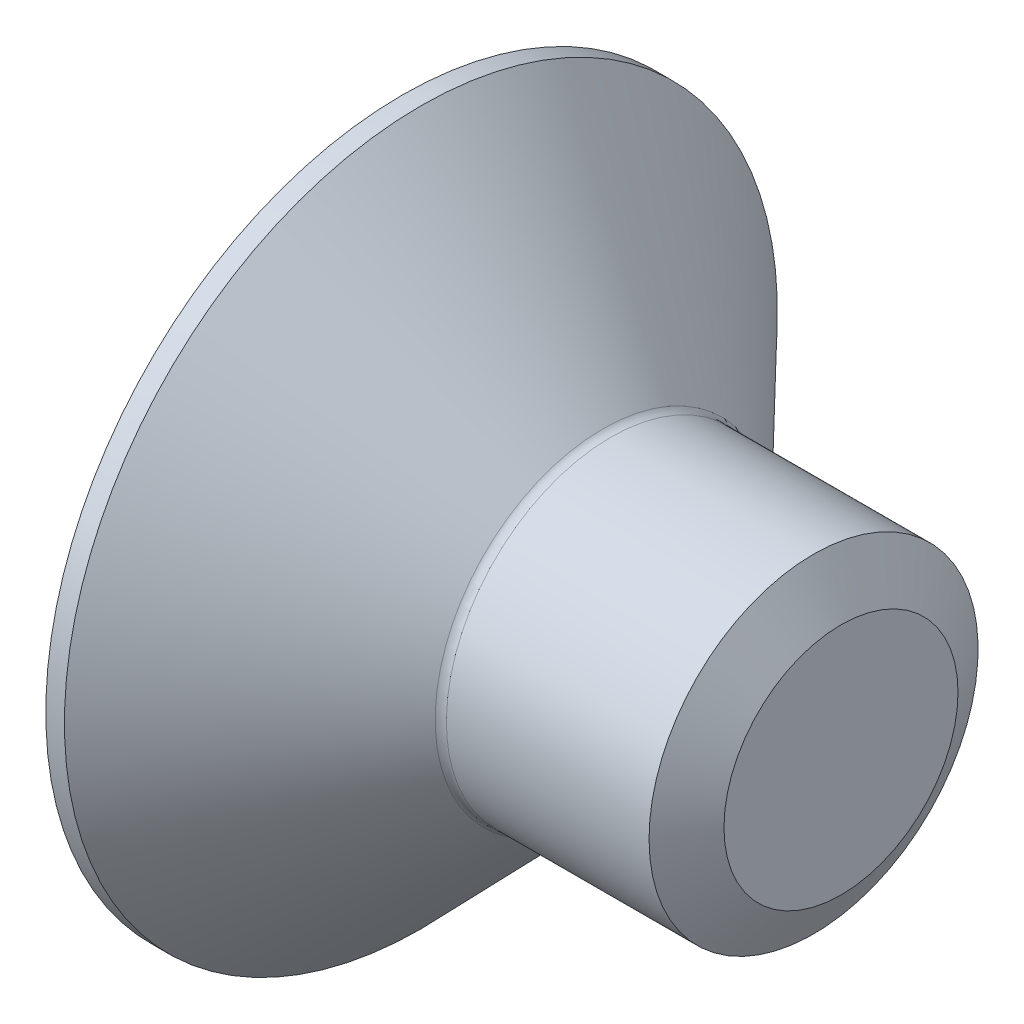
from build123d import *

# Parameters (mm, degrees)
CUT_EXTRUDE_1_DEPTH = 1.96


with BuildPart() as part:
    # 草图1 → 旋转1 (revolve)
    with BuildSketch(Plane.XY):
        with BuildLine():
            Line((0, 1.5), (-2.097552518, 1.5))
            ThreePointArc((-2.097552518, 1.5), (-2.136625631, 1.507949515), (-2.169486498, 1.530534163))
            Line((-2.169486498, 1.530534163), (-3.829955356, 3.25))
            Line((-3.829955356, 3.25), (-4, 3.25))
            Line((-4, 3.25), (-4, 0))
            Line((-4, 0), (0, 0))
            Line((0, 0), (0, 1.5))
        make_face()
    revolve(axis=Axis((0, 0, 0), (-1, 0, 0)))

    # 草图2 → 切除-拉伸1 (cut)
    with BuildSketch(Plane.ZY.offset(4)):
        Polygon((0, 1.154700538), (-1, 0.577350269), (-1, -0.577350269), (0, -1.154700538), (1, -0.577350269), (1, 0.577350269), align=None)
    extrude(amount=-CUT_EXTRUDE_1_DEPTH, mode=Mode.SUBTRACT)

    # 草图6 → 旋转2 (revolve)
    with BuildSketch(Plane.XY):
        Polygon((-2.9, 1.154700538), (-2.233333333, 0), (-1.74, 0), (-1.74, 1.154700538), align=None)
    revolve(axis=Axis((-4, 0, 0), (1, 0, 0)))

    # 草图7 → 切除-旋转2 (revolve, cut)
    with BuildSketch(Plane.XY):
        Polygon((-4, 1.154700538), (-4, 0), (-3.67, 0), align=None)
    revolve(axis=Axis((-4, 0, 0), (1, 0, 0)), mode=Mode.SUBTRACT)

    # 草图4 → 切除-旋转1 (revolve, cut)
    with BuildSketch(Plane.XY):
        Polygon((-0.25, 1.5), (0, 1.066987298), (0.25, 1.5), align=None)
    revolve(axis=Axis((-0.25, 0, 0), (1, 0, 0)), mode=Mode.SUBTRACT)


solid = part.part
